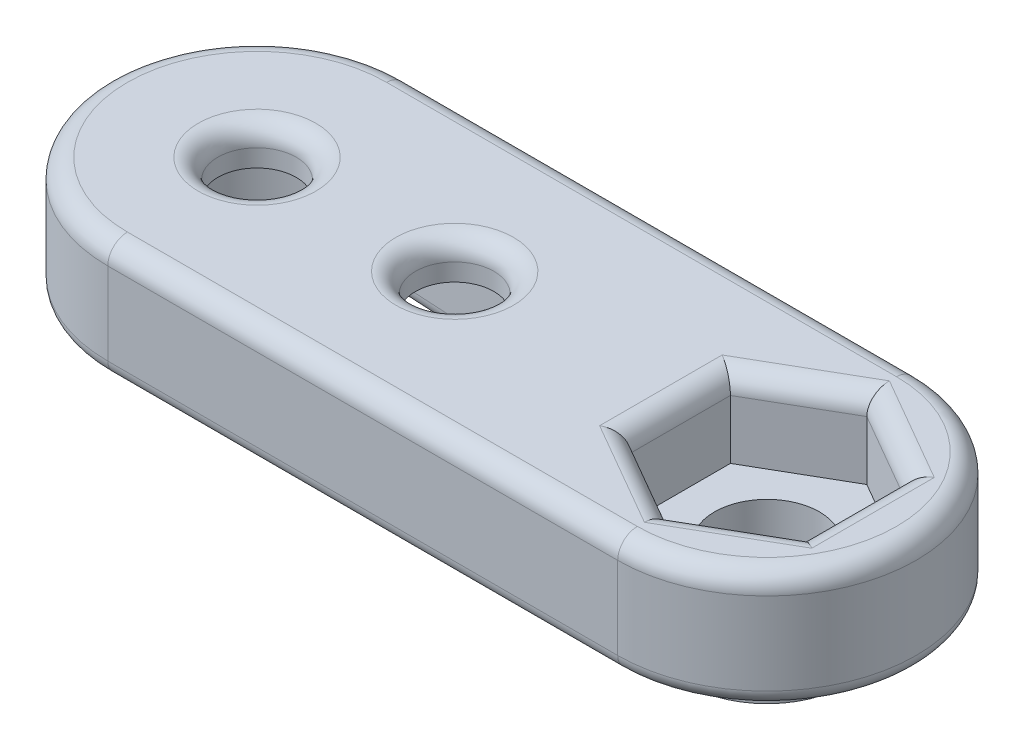
from build123d import *

# Parameters (mm, degrees)
BOSS_EXTRUDE1_DEPTH = 4.5
SKETCH2_R           = 1.5875
BOSS_EXTRUDE2_DEPTH = 1.5
CUT_EXTRUDE1_DEPTH  = 1.2375
SKETCH5_R           = 2.125
BOSS_EXTRUDE4_DEPTH = 1.5875
BOSS_EXTRUDE3_START = -6.5405
SKETCH4_R           = 3.25
SKETCH4_R_2         = 2.125
BOSS_EXTRUDE3_DEPTH = 1.778
FILLET2_R           = 0.635
FILLET3_R           = 0.79375


with BuildPart() as part:
    # Sketch1 → Boss-Extrude1 (new body)
    with BuildSketch(Plane(origin=(0, 0, 0), x_dir=(1, 0, 0), z_dir=(0, 1, 0))):
        with BuildLine():
            Line((0, 6.04), (20.6375, 6.04))
            ThreePointArc((20.6375, 6.04), (26.6775, 0), (20.6375, -6.04))
            Line((20.6375, -6.04), (0, -6.04))
            ThreePointArc((0, -6.04), (-6.04, 0), (0, 6.04))
        make_face()
        with BuildLine():
            Line((2.286372673, 2.65), (14.110293316, 1.99695653))
            ThreePointArc((14.110293316, 1.99695653), (16, 0), (14.110293316, -1.99695653))
            Line((14.110293316, -1.99695653), (2.286372673, -2.65))
            ThreePointArc((2.286372673, -2.65), (-3.5, 0), (2.286372673, 2.65))
        make_face(mode=Mode.SUBTRACT)
        Polygon((24.1375, -2.020725942), (24.1375, 2.020725942), (20.6375, 4.041451884), (17.1375, 2.020725942), (17.1375, -2.020725942), (20.6375, -4.041451884), align=None, mode=Mode.SUBTRACT)
    extrude(amount=BOSS_EXTRUDE1_DEPTH)

    # Sketch2 → Boss-Extrude2 (add)
    with BuildSketch(Plane(origin=(0, 4.5, 0), x_dir=(1, 0, 0), z_dir=(0, 1, 0))):
        with BuildLine():
            Line((20.6375, 6.04), (0, 6.04))
            ThreePointArc((0, 6.04), (-6.04, 0), (0, -6.04))
            Line((0, -6.04), (20.6375, -6.04))
            ThreePointArc((20.6375, -6.04), (26.6775, 0), (20.6375, 6.04))
        make_face()
        with Locations(Location((0, 0, 0), (0, 0, 90))):
            Circle(SKETCH2_R, mode=Mode.SUBTRACT)
        with Locations(Location((8, 0, 0), (0, 0, 90))):
            Circle(SKETCH2_R, mode=Mode.SUBTRACT)
        Polygon((24.1375, 2.020725942), (20.6375, 4.041451884), (17.1375, 2.020725942), (17.1375, -2.020725942), (20.6375, -4.041451884), (24.1375, -2.020725942), align=None, mode=Mode.SUBTRACT)
    extrude(amount=BOSS_EXTRUDE2_DEPTH)

    # Sketch3 → Cut-Extrude1 (cut)
    with BuildSketch(Plane.XZ):
        with BuildLine():
            Line((20.6375, 6.04), (0, 6.04))
            ThreePointArc((0, 6.04), (-6.04, 0), (0, -6.04))
            Line((0, -6.04), (20.6375, -6.04))
            ThreePointArc((20.6375, -6.04), (26.6775, 0), (20.6375, 6.04))
        make_face()
    extrude(amount=-CUT_EXTRUDE1_DEPTH, mode=Mode.SUBTRACT)

    # Sketch5 → Boss-Extrude4 (add)
    with BuildSketch(Plane(origin=(0, 1.2375, 0), x_dir=(1, 0, 0), z_dir=(0, 1, 0))):
        Polygon((20.6375, 4.041451884), (24.1375, 2.020725942), (24.1375, -2.020725942), (20.6375, -4.041451884), (17.1375, -2.020725942), (17.1375, 2.020725942), align=None)
        with Locations(Location((20.6375, 0, 0), (0, 0, 270))):
            Circle(SKETCH5_R, mode=Mode.SUBTRACT)
    extrude(amount=BOSS_EXTRUDE4_DEPTH)

    # Sketch4 → Boss-Extrude3 (add)
    with BuildSketch(Plane(origin=(0, 6, 0), x_dir=(1, 0, 0), z_dir=(0, 1, 0)).offset(BOSS_EXTRUDE3_START)):
        with Locations(Location((20.6375, 0, 0), (0, 0, 90))):
            Circle(SKETCH4_R)
        with Locations(Location((20.6375, 0, 0), (0, 0, 90))):
            Circle(SKETCH4_R_2, mode=Mode.SUBTRACT)
    extrude(amount=BOSS_EXTRUDE3_DEPTH)

    # Fillet2
    fillet2_edges = [part.edges().sort_by_distance(p)[0] for p in [
        (20.6375, 1.2375, 3.25),
        (8.198332995, 1.2375, 2.323478265),
        (-3.5, 1.2375, 0),
        (8.198332995, 1.2375, -2.323478265),
        (16, 1.2375, 0),
        (26.6775, 1.2375, 0),
        (10.31875, 1.2375, -6.04),
        (-6.04, 1.2375, 0),
        (10.31875, 1.2375, 6.04),
    ]]
    fillet(fillet2_edges, radius=FILLET2_R)

    # Fillet3
    fillet3_edges = [part.edges().sort_by_distance(p)[0] for p in [
        (26.6775, 6, 0),
        (10.31875, 6, -6.04),
        (-6.04, 6, 0),
        (10.31875, 6, 6.04),
        (8, 6, 1.5875),
        (24.1375, 6, 0),
        (22.3875, 6, 3.031088913),
        (18.8875, 6, 3.031088913),
        (17.1375, 6, 0),
        (18.8875, 6, -3.031088913),
        (22.3875, 6, -3.031088913),
        (0, 6, 1.5875),
    ]]
    fillet(fillet3_edges, radius=FILLET3_R)


solid = part.part
